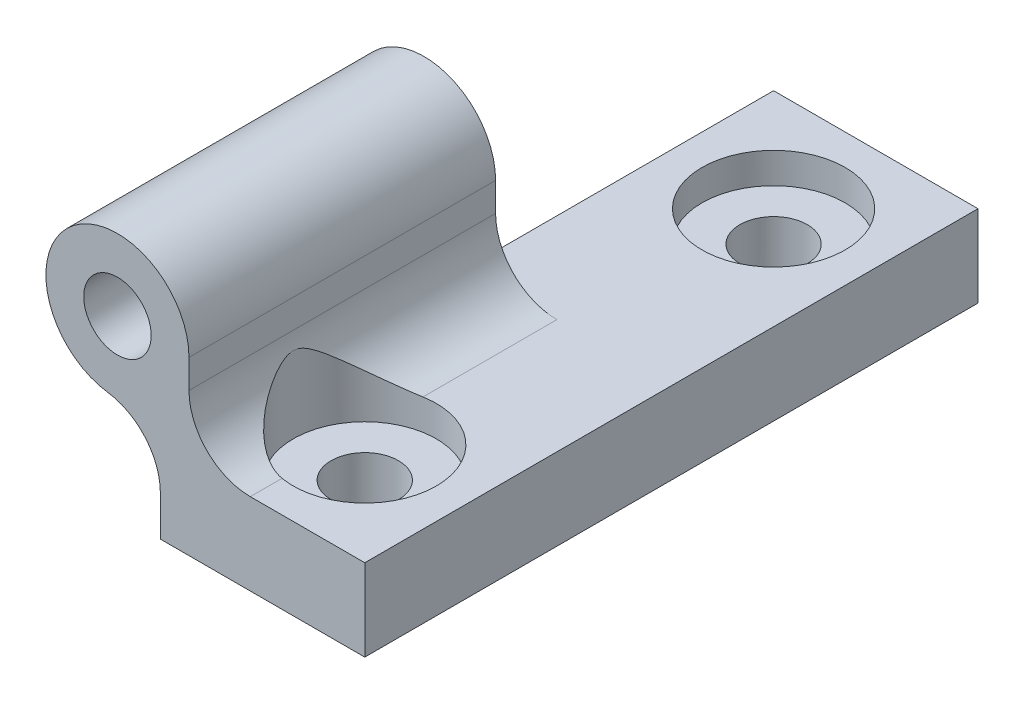
from build123d import *

# Parameters (mm, degrees)
SKETCH1_R               = 3.5
SKETCH1_R_2             = 1.65
SKETCH1_W               = 10
SKETCH1_H               = 4
BOSS_EXTRUDE1_DEPTH     = 30
FILLET1_R               = 3
FILLET2_R               = 3
CUT_EXTRUDE1_DEPTH      = 15
CUT_EXTRUDE2_DEPTH      = 7
CUT_EXTRUDE2_DEPTH_BACK = 15
SKETCH3_R               = 1.65
CUT_EXTRUDE3_DEPTH      = 15
CUT_EXTRUDE3_DEPTH_BACK = 1.5
SKETCH4_R               = 3.5


with BuildPart() as part:
    # Sketch1 → Boss-Extrude1 (new body)
    # profile 1 of 3: a face of its own
    with BuildSketch(Plane.XY):
        with Locations((-2.1, 8.4)):
            Circle(SKETCH1_R)
        with Locations((-2.1, 8.4)):
            Circle(SKETCH1_R_2, mode=Mode.SUBTRACT)
    # profile 2 of 3: a face of its own
    with BuildSketch(Plane.XY):
        with BuildLine():
            Line((0, 5.6), (0, 4))
            Line((0, 4), (1.4, 4))
            Line((1.4, 4), (1.4, 8.4))
            ThreePointArc((1.4, 8.4), (1.030495168, 6.834752416), (0, 5.6))
        make_face()
    # profile 3 of 3: a face of its own
    with BuildSketch(Plane.XY):
        with Locations((5, 2)):
            Rectangle(SKETCH1_W, SKETCH1_H)
    extrude(amount=-BOSS_EXTRUDE1_DEPTH)

    # Fillet1
    fillet1_edges = [part.edges().sort_by_distance(p)[0] for p in [
        (1.4, 4, -15),
    ]]
    fillet(fillet1_edges, radius=FILLET1_R)

    # Fillet2
    fillet2_edges = [part.edges().sort_by_distance(p)[0] for p in [
        (0, 5.6, -15),
    ]]
    fillet(fillet2_edges, radius=FILLET2_R)

    # Sketch2 → Cut-Extrude1 (cut)
    with BuildSketch(Plane(origin=(0, 0, -30), x_dir=(-1, 0, 0), z_dir=(0, 0, -1))):
        Polygon((-4.4, 4), (0, 4), (0, 0), (6.883389495, 0), (6.883389495, 4), (6.883389495, 12.878531322), (-4.4, 12.878531322), align=None)
    extrude(amount=-CUT_EXTRUDE1_DEPTH, mode=Mode.SUBTRACT)

    # Sketch3 → Cut-Extrude2 (cut, two sides: drawn at the far end of the back side and taken through both)
    with BuildSketch(Plane(origin=(0, 4, 0), x_dir=(1, 0, 0), z_dir=(0, 1, 0)).offset(-CUT_EXTRUDE2_DEPTH_BACK)):
        with Locations(Location((5, 5, 0), (0, 0, 90))):
            Circle(SKETCH3_R)
        with Locations(Location((5, 25, 0), (0, 0, 90))):
            Circle(SKETCH3_R)
    extrude(amount=CUT_EXTRUDE2_DEPTH + CUT_EXTRUDE2_DEPTH_BACK, mode=Mode.SUBTRACT)

    # Sketch4 → Cut-Extrude3 (cut, two sides: drawn at the far end of the back side and taken through both)
    with BuildSketch(Plane(origin=(0, 4, 0), x_dir=(1, 0, 0), z_dir=(0, 1, 0)).offset(-CUT_EXTRUDE3_DEPTH_BACK)):
        with Locations(Location((5, 5, 0), (0, 0, 99.870889606))):
            Circle(SKETCH4_R)
        with Locations(Location((5, 25, 0), (0, 0, 90))):
            Circle(SKETCH4_R)
    extrude(amount=CUT_EXTRUDE3_DEPTH + CUT_EXTRUDE3_DEPTH_BACK, mode=Mode.SUBTRACT)


solid = part.part
